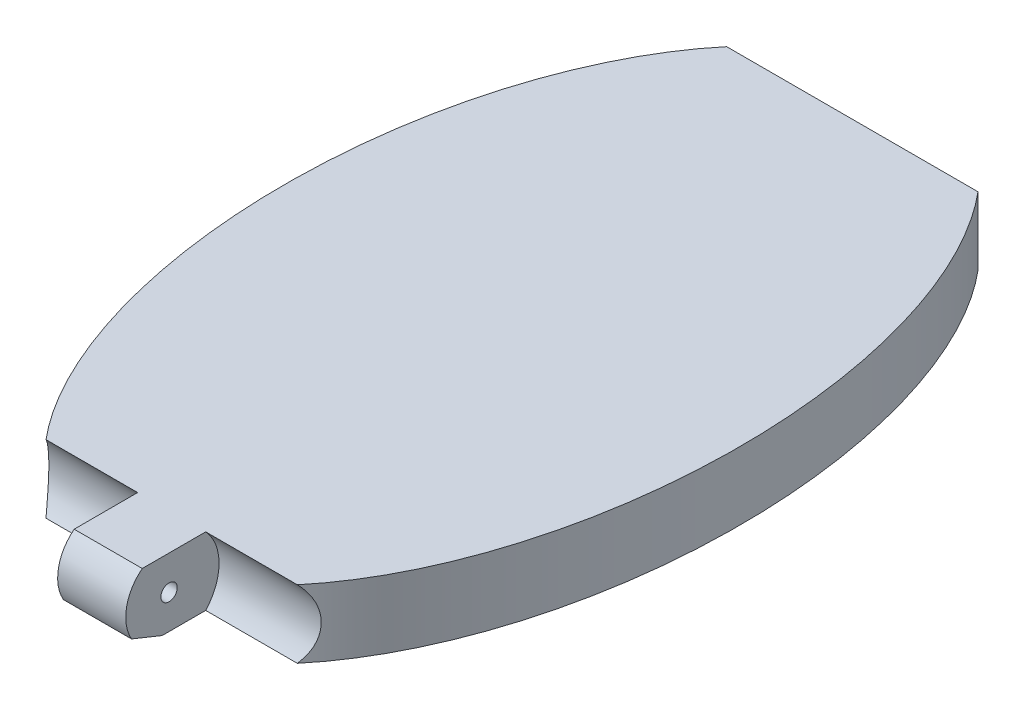
from build123d import *

# Parameters (mm, degrees)
SKETCH1_RX               = 38.1
SKETCH1_RY               = 21.209
BOSS_EXTRUDE1_DEPTH      = 6.35
CUT_EXTRUDE6_DEPTH       = 45.065339906
SKETCH35_W               = 18.034
SKETCH35_H               = 6.35
CUT_EXTRUDE17_DEPTH      = 45.065339906
SKETCH36_R               = 0.762
CUT_EXTRUDE18_DEPTH      = 46.678353405
SKETCH37_R               = 4.664778091
CUT_EXTRUDE19_DEPTH      = 46.678353405
SKETCH38_R               = 4.664778091
CUT_EXTRUDE20_DEPTH      = 46.678353405
CUT_EXTRUDE21_DEPTH      = 46.678353405
CUT_EXTRUDE21_DEPTH_BACK = 46.678353405
SKETCH39_W               = 2.364149351
SKETCH39_H               = 6.35
BOSS_EXTRUDE2_DEPTH      = 6.35
CUT_EXTRUDE22_DEPTH      = 46.029039702
CUT_EXTRUDE22_DEPTH_BACK = 46.029039702


with BuildPart() as part:
    # Sketch1 → Boss-Extrude1 (new body)
    with BuildSketch(Plane(origin=(0, 0, 0), x_dir=(1, 0, 0), z_dir=(0, 1, 0))):
        with Locations(Location((0, 0), (0, 0, 90))):
            Ellipse(SKETCH1_RX, SKETCH1_RY)
    extrude(amount=BOSS_EXTRUDE1_DEPTH)

    # Sketch7 → Cut-Extrude6 (cut, through all)
    with BuildSketch(Plane(origin=(0, 6.35, 0), x_dir=(1, 0, 0), z_dir=(0, 1, 0))):
        with BuildLine():
            Line((-11.723715863, 31.75), (11.723715863, 31.75))
            add(Edge.make_bspline(
                [(11.723715863, 31.75), (0, 45.72), (-11.723715863, 31.75)],
                knots=[5.697499764, 5.697499764, 5.697499764, 6.868870851, 6.868870851, 6.868870851], degree=2, weights=[1, 0.833333333, 1]))
        make_face()
    extrude(amount=-CUT_EXTRUDE6_DEPTH, mode=Mode.SUBTRACT)

    # Sketch35 → Cut-Extrude17 (cut, through all)
    with BuildSketch(Plane(origin=(0, 6.35, 0), x_dir=(1, 0, 0), z_dir=(0, 1, 0))):
        with Locations((12.192, -34.925)):
            Rectangle(SKETCH35_W, SKETCH35_H)
        with Locations((-12.192, -34.925)):
            Rectangle(SKETCH35_W, SKETCH35_H)
    extrude(amount=-CUT_EXTRUDE17_DEPTH, mode=Mode.SUBTRACT)

    # Sketch36 → Cut-Extrude18 (cut, through all)
    with BuildSketch(Plane.ZY.offset(3.175)):
        with Locations((35.167532682, 3.175)):
            Circle(SKETCH36_R)
    extrude(amount=-CUT_EXTRUDE18_DEPTH, mode=Mode.SUBTRACT)

    # Sketch37 → Cut-Extrude19 (cut, through all)
    with BuildSketch(Plane.ZY.offset(3.175)):
        with Locations((35.167532682, 3.175)):
            Circle(SKETCH37_R)
    extrude(amount=CUT_EXTRUDE19_DEPTH, mode=Mode.SUBTRACT)

    # Sketch38 → Cut-Extrude20 (cut, through all)
    with BuildSketch(Plane(origin=(3.175, 0, 0), x_dir=(0, 0, -1), z_dir=(1, 0, 0))):
        with Locations((-35.167532682, 3.175)):
            Circle(SKETCH38_R)
    extrude(amount=CUT_EXTRUDE20_DEPTH, mode=Mode.SUBTRACT)

    # Sketch39 → Cut-Extrude21 (cut, two sides: drawn at the far end of the back side and taken through both)
    with BuildSketch(Plane.ZY.offset(3.175).offset(-CUT_EXTRUDE21_DEPTH_BACK)):
        with Locations((38.852740041, 3.175)):
            Rectangle(SKETCH39_W, SKETCH39_H)
    extrude(amount=CUT_EXTRUDE21_DEPTH + CUT_EXTRUDE21_DEPTH_BACK, mode=Mode.SUBTRACT)

    # Sketch40 → Boss-Extrude2 (add)
    with BuildSketch(Plane.ZY.offset(3.175)):
        with BuildLine():
            Line((37.670665365, 6.35), (37.670665365, 0))
            ThreePointArc((37.670665365, 0), (39.210588238, 3.175), (37.670665365, 6.35))
        make_face()
    extrude(amount=-BOSS_EXTRUDE2_DEPTH)

    # Sketch41 → Cut-Extrude22 (cut, two sides: drawn at the far end of the back side and taken through both)
    with BuildSketch(Plane(origin=(0, 0, 0), x_dir=(0, 0, -1), z_dir=(1, 0, 0)).offset(-CUT_EXTRUDE22_DEPTH_BACK)):
        Polygon((-35.808924316, 0), (-40.546826373, 1.914236687), (-40.546826373, -0.644343838), (-35.808924316, -0.644343838), align=None)
    extrude(amount=CUT_EXTRUDE22_DEPTH + CUT_EXTRUDE22_DEPTH_BACK, mode=Mode.SUBTRACT)


solid = part.part
